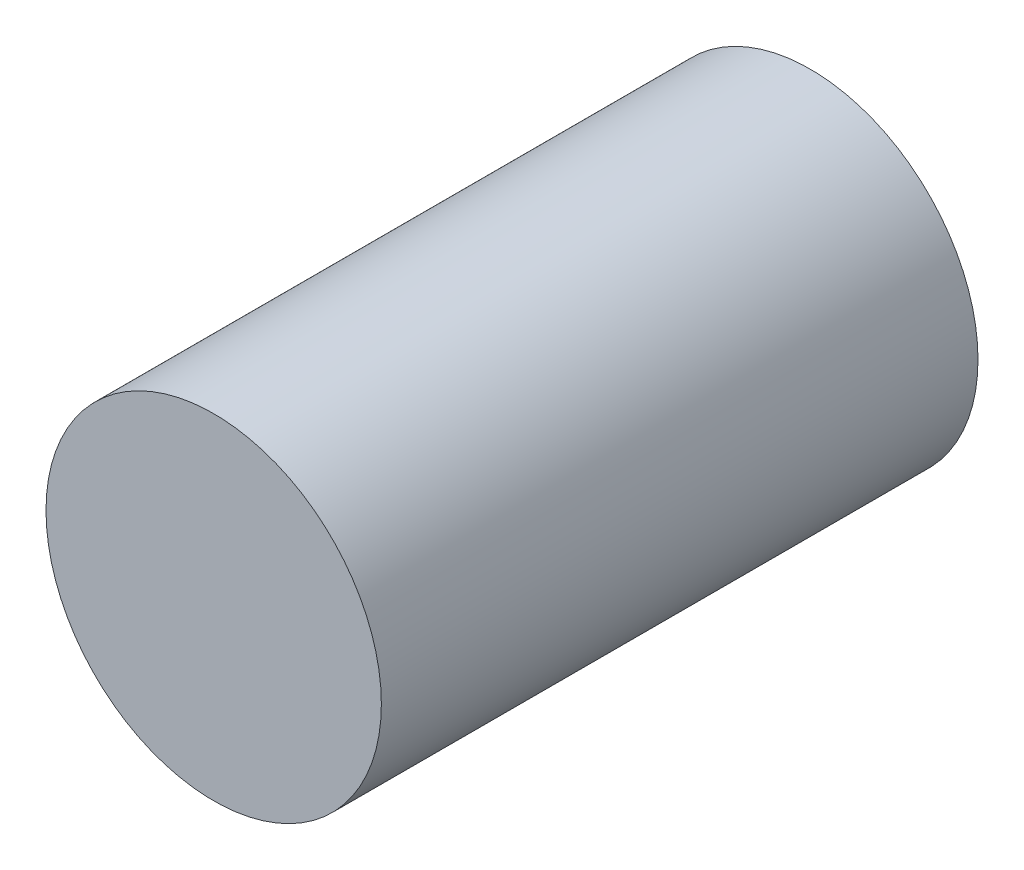
from build123d import *

# Parameters (mm, degrees)
SKETCH_1_R  = 3.8
CABLE_DEPTH = 13.520724833


with BuildPart() as part:
    # 草图1 → Cable (new body)
    with BuildSketch(Plane.XY):
        with Locations(Location((0, 0, 0), (0, 0, 180))):
            Circle(SKETCH_1_R)
    extrude(amount=CABLE_DEPTH)


solid = part.part
